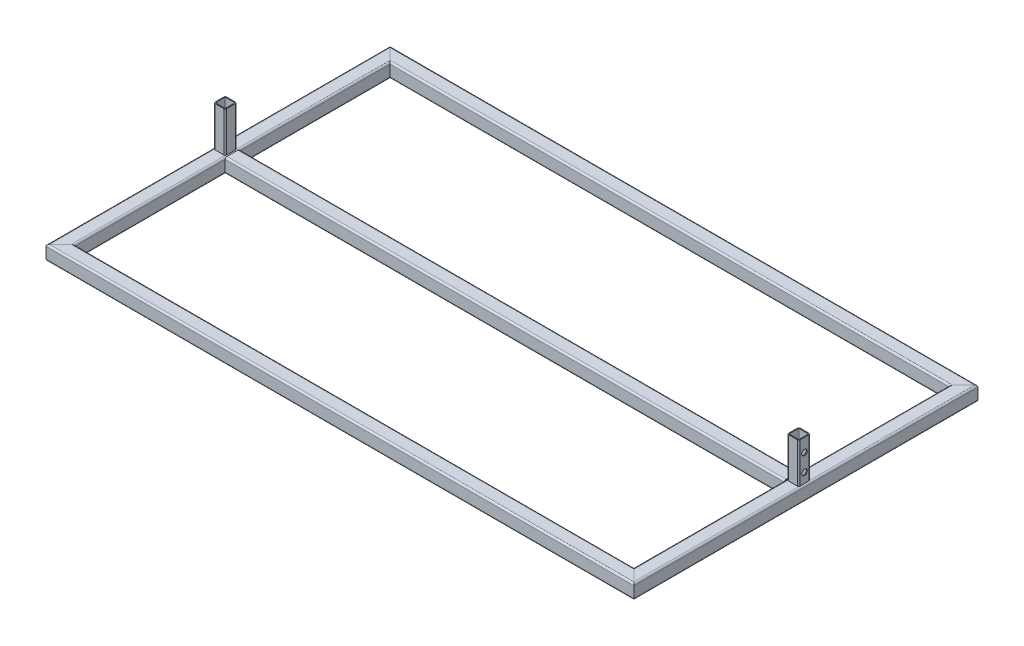
from build123d import *

# Parameters (mm, degrees)
SQUARE_TUBE_CONFIGURED_20_X_20_X_2_1_DEPTH      = 1018.67766953
SQUARE_TUBE_CONFIGURED_20_X_20_X_2_1_DEPTH_BACK = 18.67766953
SQUARE_TUBE_CONFIGURED_20_X_20_X_2_1_2_DEPTH    = 612.355339059
SQUARE_TUBE_CONFIGURED_20_X_20_X_2_1_3_DEPTH    = 1037.355339059
SQUARE_TUBE_CONFIGURED_20_X_20_X_2_1_4_DEPTH    = 612.355339059
SQUARE_TUBE_CONFIGURED_20_X_20_X_2_1_5_DEPTH    = 1002
SQUARE_TUBE_CONFIGURED_20_X_20_X_2_11_DEPTH     = 82.5
SQUARE_TUBE_CONFIGURED_20_X_20_X_2_12_DEPTH     = 82.5
CUT_EXTRUDE_2_DEPTH                             = 5
MIRROR_2_COPY_1_DEPTH                           = 5
CUT_EXTRUDE_3_DEPTH                             = 1.5
CUT_EXTRUDE_4_DEPTH                             = 1.5


with BuildPart() as part:
    # Sketch11 → Square tube - configured 20 X 20 X 2(1) (new, two sides: drawn at the far end of the back side and taken through both)
    with BuildSketch(Plane(origin=(-500, 0, -287.5), x_dir=(0, 0, -1), z_dir=(1, 0, 0)).offset(-SQUARE_TUBE_CONFIGURED_20_X_20_X_2_1_DEPTH_BACK)):
        with BuildLine():
            Line((-9.5, -12.5), (9.5, -12.5))
            ThreePointArc((9.5, -12.5), (11.621320344, -11.621320344), (12.5, -9.5))
            Line((12.5, -9.5), (12.5, 9.5))
            ThreePointArc((12.5, 9.5), (11.621320344, 11.621320344), (9.5, 12.5))
            Line((9.5, 12.5), (-9.5, 12.5))
            ThreePointArc((-9.5, 12.5), (-11.621320344, 11.621320344), (-12.5, 9.5))
            Line((-12.5, 9.5), (-12.5, -9.5))
            ThreePointArc((-12.5, -9.5), (-11.621320344, -11.621320344), (-9.5, -12.5))
        make_face()
        with BuildLine():
            Line((-9.5, -11), (9.5, -11))
            ThreePointArc((9.5, -11), (10.560660172, -10.560660172), (11, -9.5))
            Line((11, -9.5), (11, 9.5))
            ThreePointArc((11, 9.5), (10.560660172, 10.560660172), (9.5, 11))
            Line((9.5, 11), (-9.5, 11))
            ThreePointArc((-9.5, 11), (-10.560660172, 10.560660172), (-11, 9.5))
            Line((-11, 9.5), (-11, -9.5))
            ThreePointArc((-11, -9.5), (-10.560660172, -10.560660172), (-9.5, -11))
        make_face(mode=Mode.SUBTRACT)
    extrude(amount=SQUARE_TUBE_CONFIGURED_20_X_20_X_2_1_DEPTH + SQUARE_TUBE_CONFIGURED_20_X_20_X_2_1_DEPTH_BACK)

    # Square tube - configured 20 X 20 X 2(1) m
    split(bisect_by=Plane(origin=(-500, 0, -287.5), x_dir=(0, 1, 0), z_dir=(0.707106781, 0, -0.707106781)), keep=Keep.TOP)

    # Square tube - configured 20 X 20 X 2 2
    split(bisect_by=Plane(origin=(500, 0, -287.5), x_dir=(0, -1, 0), z_dir=(-0.707106781, 0, -0.707106781)), keep=Keep.TOP)


with BuildPart() as body_2:
    # Sketch11 on segment 2 (carried to segment 2) → Square tube - configured 20 X 20 X 2_1 2 (new body)
    with BuildSketch(Plane(origin=(500, 0, -306.17766953), x_dir=(1, 0, 0), z_dir=(0, 0, 1))):
        with BuildLine():
            Line((-9.5, -12.5), (9.5, -12.5))
            ThreePointArc((9.5, -12.5), (11.621320344, -11.621320344), (12.5, -9.5))
            Line((12.5, -9.5), (12.5, 9.5))
            ThreePointArc((12.5, 9.5), (11.621320344, 11.621320344), (9.5, 12.5))
            Line((9.5, 12.5), (-9.5, 12.5))
            ThreePointArc((-9.5, 12.5), (-11.621320344, 11.621320344), (-12.5, 9.5))
            Line((-12.5, 9.5), (-12.5, -9.5))
            ThreePointArc((-12.5, -9.5), (-11.621320344, -11.621320344), (-9.5, -12.5))
        make_face()
        with BuildLine():
            Line((-9.5, -11), (9.5, -11))
            ThreePointArc((9.5, -11), (10.560660172, -10.560660172), (11, -9.5))
            Line((11, -9.5), (11, 9.5))
            ThreePointArc((11, 9.5), (10.560660172, 10.560660172), (9.5, 11))
            Line((9.5, 11), (-9.5, 11))
            ThreePointArc((-9.5, 11), (-10.560660172, 10.560660172), (-11, 9.5))
            Line((-11, 9.5), (-11, -9.5))
            ThreePointArc((-11, -9.5), (-10.560660172, -10.560660172), (-9.5, -11))
        make_face(mode=Mode.SUBTRACT)
    extrude(amount=SQUARE_TUBE_CONFIGURED_20_X_20_X_2_1_2_DEPTH)

    # Square tube - configured 20 X 20 X 2 3
    split(bisect_by=Plane(origin=(500, 0, 287.5), x_dir=(0, 1, 0), z_dir=(0.707106781, 0, -0.707106781)), keep=Keep.TOP)

    # Square tube - configured 20 X 20 X 2 4
    split(bisect_by=Plane(origin=(500, 0, -287.5), x_dir=(0, 1, 0), z_dir=(0.707106781, 0, 0.707106781)), keep=Keep.TOP)


with BuildPart() as body_3:
    # Sketch11 on segment 3 (carried to segment 3) → Square tube - configured 20 X 20 X 2_1 3 (new body)
    with BuildSketch(Plane(origin=(518.67766953, 0, 287.5), x_dir=(0, 0, 1), z_dir=(-1, 0, 0))):
        with BuildLine():
            Line((-9.5, -12.5), (9.5, -12.5))
            ThreePointArc((9.5, -12.5), (11.621320344, -11.621320344), (12.5, -9.5))
            Line((12.5, -9.5), (12.5, 9.5))
            ThreePointArc((12.5, 9.5), (11.621320344, 11.621320344), (9.5, 12.5))
            Line((9.5, 12.5), (-9.5, 12.5))
            ThreePointArc((-9.5, 12.5), (-11.621320344, 11.621320344), (-12.5, 9.5))
            Line((-12.5, 9.5), (-12.5, -9.5))
            ThreePointArc((-12.5, -9.5), (-11.621320344, -11.621320344), (-9.5, -12.5))
        make_face()
        with BuildLine():
            Line((-9.5, -11), (9.5, -11))
            ThreePointArc((9.5, -11), (10.560660172, -10.560660172), (11, -9.5))
            Line((11, -9.5), (11, 9.5))
            ThreePointArc((11, 9.5), (10.560660172, 10.560660172), (9.5, 11))
            Line((9.5, 11), (-9.5, 11))
            ThreePointArc((-9.5, 11), (-10.560660172, 10.560660172), (-11, 9.5))
            Line((-11, 9.5), (-11, -9.5))
            ThreePointArc((-11, -9.5), (-10.560660172, -10.560660172), (-9.5, -11))
        make_face(mode=Mode.SUBTRACT)
    extrude(amount=SQUARE_TUBE_CONFIGURED_20_X_20_X_2_1_3_DEPTH)

    # Square tube - configured 20 X 20 X 2 5
    split(bisect_by=Plane(origin=(-500, 0, 287.5), x_dir=(0, 1, 0), z_dir=(0.707106781, 0, 0.707106781)), keep=Keep.TOP)

    # Square tube - configured 20 X 20 X 2 6
    split(bisect_by=Plane(origin=(500, 0, 287.5), x_dir=(0, -1, 0), z_dir=(-0.707106781, 0, 0.707106781)), keep=Keep.TOP)

    # Эскиз3 → Вырез-Вытянуть2 (cut)
    with BuildSketch(Plane(origin=(0, -12.5, 0), x_dir=(-1, 0, 0), z_dir=(0, -1, 0))):
        Polygon((482.113248654, -292.5), (487.886751346, -292.5), (490.773502692, -287.5), (487.886751346, -282.5), (482.113248654, -282.5), (479.226497308, -287.5), align=None)
    cut_extrude_2 = extrude(amount=-CUT_EXTRUDE_2_DEPTH, mode=Mode.SUBTRACT)

    # Зеркальное отражение1: Вырез-Вытянуть2 across plane
    add(cut_extrude_2.mirror(Plane(origin=(0, 0, 0), x_dir=(0, 0, 1), z_dir=(1, 0, 0))), mode=Mode.SUBTRACT)


with BuildPart() as body_4:
    # Sketch11 on segment 4 (carried to segment 4) → Square tube - configured 20 X 20 X 2_1 4 (new body)
    with BuildSketch(Plane(origin=(-500, 0, 306.17766953), x_dir=(-1, 0, 0), z_dir=(0, 0, -1))):
        with BuildLine():
            Line((-9.5, -12.5), (9.5, -12.5))
            ThreePointArc((9.5, -12.5), (11.621320344, -11.621320344), (12.5, -9.5))
            Line((12.5, -9.5), (12.5, 9.5))
            ThreePointArc((12.5, 9.5), (11.621320344, 11.621320344), (9.5, 12.5))
            Line((9.5, 12.5), (-9.5, 12.5))
            ThreePointArc((-9.5, 12.5), (-11.621320344, 11.621320344), (-12.5, 9.5))
            Line((-12.5, 9.5), (-12.5, -9.5))
            ThreePointArc((-12.5, -9.5), (-11.621320344, -11.621320344), (-9.5, -12.5))
        make_face()
        with BuildLine():
            Line((-9.5, -11), (9.5, -11))
            ThreePointArc((9.5, -11), (10.560660172, -10.560660172), (11, -9.5))
            Line((11, -9.5), (11, 9.5))
            ThreePointArc((11, 9.5), (10.560660172, 10.560660172), (9.5, 11))
            Line((9.5, 11), (-9.5, 11))
            ThreePointArc((-9.5, 11), (-10.560660172, 10.560660172), (-11, 9.5))
            Line((-11, 9.5), (-11, -9.5))
            ThreePointArc((-11, -9.5), (-10.560660172, -10.560660172), (-9.5, -11))
        make_face(mode=Mode.SUBTRACT)
    extrude(amount=SQUARE_TUBE_CONFIGURED_20_X_20_X_2_1_4_DEPTH)

    # Square tube - configured 20 X 20 X 2 7
    split(bisect_by=Plane(origin=(-500, 0, 287.5), x_dir=(0, -1, 0), z_dir=(-0.707106781, 0, -0.707106781)), keep=Keep.TOP)

    # Square tube - configured 20 X 20 X 2 8
    split(bisect_by=Plane(origin=(-500, 0, -287.5), x_dir=(0, -1, 0), z_dir=(-0.707106781, 0, 0.707106781)), keep=Keep.TOP)


with BuildPart() as body_5:
    # Sketch11 on segment 5 (carried to segment 5) → Square tube - configured 20 X 20 X 2_1 5 (new body)
    with BuildSketch(Plane(origin=(-501, 0, 0), x_dir=(0, 0, -1), z_dir=(1, 0, 0))):
        with BuildLine():
            Line((-9.5, -12.5), (9.5, -12.5))
            ThreePointArc((9.5, -12.5), (11.621320344, -11.621320344), (12.5, -9.5))
            Line((12.5, -9.5), (12.5, 9.5))
            ThreePointArc((12.5, 9.5), (11.621320344, 11.621320344), (9.5, 12.5))
            Line((9.5, 12.5), (-9.5, 12.5))
            ThreePointArc((-9.5, 12.5), (-11.621320344, 11.621320344), (-12.5, 9.5))
            Line((-12.5, 9.5), (-12.5, -9.5))
            ThreePointArc((-12.5, -9.5), (-11.621320344, -11.621320344), (-9.5, -12.5))
        make_face()
        with BuildLine():
            Line((-9.5, -11), (9.5, -11))
            ThreePointArc((9.5, -11), (10.560660172, -10.560660172), (11, -9.5))
            Line((11, -9.5), (11, 9.5))
            ThreePointArc((11, 9.5), (10.560660172, 10.560660172), (9.5, 11))
            Line((9.5, 11), (-9.5, 11))
            ThreePointArc((-9.5, 11), (-10.560660172, 10.560660172), (-11, 9.5))
            Line((-11, 9.5), (-11, -9.5))
            ThreePointArc((-11, -9.5), (-10.560660172, -10.560660172), (-9.5, -11))
        make_face(mode=Mode.SUBTRACT)
    extrude(amount=SQUARE_TUBE_CONFIGURED_20_X_20_X_2_1_5_DEPTH)

    # Square tube - configured 20 X 20 X 2 9
    split(bisect_by=Plane.YZ.offset(-487.5), keep=Keep.TOP)

    # Square tube - configured 20 X 20 X 2 10
    split(bisect_by=Plane(origin=(487.5, 0, 0), x_dir=(0, -1, 0), z_dir=(-1, 0, 0)), keep=Keep.TOP)


with BuildPart() as body_6:
    # Sketch1 → Square tube - configured 20 X 20 X 2 11 (new body)
    with BuildSketch(Plane(origin=(-500, 0, 0), x_dir=(1, 0, 0), z_dir=(0, 1, 0))):
        with BuildLine():
            Line((-7.5, -10), (7.5, -10))
            ThreePointArc((7.5, -10), (9.267766953, -9.267766953), (10, -7.5))
            Line((10, -7.5), (10, 7.5))
            ThreePointArc((10, 7.5), (9.267766953, 9.267766953), (7.5, 10))
            Line((7.5, 10), (-7.5, 10))
            ThreePointArc((-7.5, 10), (-9.267766953, 9.267766953), (-10, 7.5))
            Line((-10, 7.5), (-10, -7.5))
            ThreePointArc((-10, -7.5), (-9.267766953, -9.267766953), (-7.5, -10))
        make_face()
        with BuildLine():
            Line((-7.5, -8.5), (7.5, -8.5))
            ThreePointArc((7.5, -8.5), (8.207106781, -8.207106781), (8.5, -7.5))
            Line((8.5, -7.5), (8.5, 7.5))
            ThreePointArc((8.5, 7.5), (8.207106781, 8.207106781), (7.5, 8.5))
            Line((7.5, 8.5), (-7.5, 8.5))
            ThreePointArc((-7.5, 8.5), (-8.207106781, 8.207106781), (-8.5, 7.5))
            Line((-8.5, 7.5), (-8.5, -7.5))
            ThreePointArc((-8.5, -7.5), (-8.207106781, -8.207106781), (-7.5, -8.5))
        make_face(mode=Mode.SUBTRACT)
    extrude(amount=SQUARE_TUBE_CONFIGURED_20_X_20_X_2_11_DEPTH)

    # Weld Trim 1
    split(bisect_by=Plane(origin=(500.104637681, 12.5, 0), x_dir=(-1, 0, 0), z_dir=(0, 1, 0)), keep=Keep.TOP)

    # Эскиз4 → Вырез-Вытянуть3 (cut)
    with BuildSketch(Plane(origin=(-510, 0, 0), x_dir=(0, 0, -1), z_dir=(1, 0, 0))):
        Polygon((-5.311622477, 59.5), (-2.655811238, 54.9), (2.655811238, 54.9), (5.311622477, 59.5), (2.655811238, 64.1), (-2.655811238, 64.1), align=None)
        Polygon((-5.311622477, 29.5), (-2.655811238, 24.9), (2.655811238, 24.9), (5.311622477, 29.5), (2.655811238, 34.1), (-2.655811238, 34.1), align=None)
    extrude(amount=CUT_EXTRUDE_3_DEPTH, mode=Mode.SUBTRACT)


with BuildPart() as body_7:
    # Sketch1 on segment 2 (carried to segment 2) → Square tube - configured 20 X 20 X 2 12 (new body)
    with BuildSketch(Plane(origin=(500, 0, 0), x_dir=(1, 0, 0), z_dir=(0, 1, 0))):
        with BuildLine():
            Line((-7.5, -10), (7.5, -10))
            ThreePointArc((7.5, -10), (9.267766953, -9.267766953), (10, -7.5))
            Line((10, -7.5), (10, 7.5))
            ThreePointArc((10, 7.5), (9.267766953, 9.267766953), (7.5, 10))
            Line((7.5, 10), (-7.5, 10))
            ThreePointArc((-7.5, 10), (-9.267766953, 9.267766953), (-10, 7.5))
            Line((-10, 7.5), (-10, -7.5))
            ThreePointArc((-10, -7.5), (-9.267766953, -9.267766953), (-7.5, -10))
        make_face()
        with BuildLine():
            Line((-7.5, -8.5), (7.5, -8.5))
            ThreePointArc((7.5, -8.5), (8.207106781, -8.207106781), (8.5, -7.5))
            Line((8.5, -7.5), (8.5, 7.5))
            ThreePointArc((8.5, 7.5), (8.207106781, 8.207106781), (7.5, 8.5))
            Line((7.5, 8.5), (-7.5, 8.5))
            ThreePointArc((-7.5, 8.5), (-8.207106781, 8.207106781), (-8.5, 7.5))
            Line((-8.5, 7.5), (-8.5, -7.5))
            ThreePointArc((-8.5, -7.5), (-8.207106781, -8.207106781), (-7.5, -8.5))
        make_face(mode=Mode.SUBTRACT)
    extrude(amount=SQUARE_TUBE_CONFIGURED_20_X_20_X_2_12_DEPTH)

    # Weld Trim 1
    split(bisect_by=Plane(origin=(500.104637681, 12.5, 0), x_dir=(-1, 0, 0), z_dir=(0, 1, 0)), keep=Keep.TOP)

    # Эскиз5 → Вырез-Вытянуть4 (cut)
    with BuildSketch(Plane(origin=(510, 0, 0), x_dir=(0, 0, -1), z_dir=(1, 0, 0))):
        Polygon((-5.311622477, 59.5), (-2.655811238, 54.9), (2.655811238, 54.9), (5.311622477, 59.5), (2.655811238, 64.1), (-2.655811238, 64.1), align=None)
        Polygon((2.655811238, 24.9), (5.311622477, 29.5), (2.655811238, 34.1), (-2.655811238, 34.1), (-5.311622477, 29.5), (-2.655811238, 24.9), align=None)
    extrude(amount=-CUT_EXTRUDE_4_DEPTH, mode=Mode.SUBTRACT)


with BuildPart() as part_1:
    add(part.part)

    # Зеркальное отражение2: Вырез-Вытянуть2 across plane
    add(cut_extrude_2.mirror(Plane.XY), mode=Mode.SUBTRACT)

    # Зеркальное отражение2 copy 1 sketch → Зеркальное отражение2 copy 1 (cut)
    with BuildSketch(Plane.XZ.offset(12.5)):
        Polygon((482.113248654, -292.5), (487.886751346, -292.5), (490.773502692, -287.5), (487.886751346, -282.5), (482.113248654, -282.5), (479.226497308, -287.5), align=None)
    extrude(amount=-MIRROR_2_COPY_1_DEPTH, mode=Mode.SUBTRACT)


solid = Compound([body_2.part, body_3.part, body_4.part, body_5.part, body_6.part, body_7.part, part_1.part])
